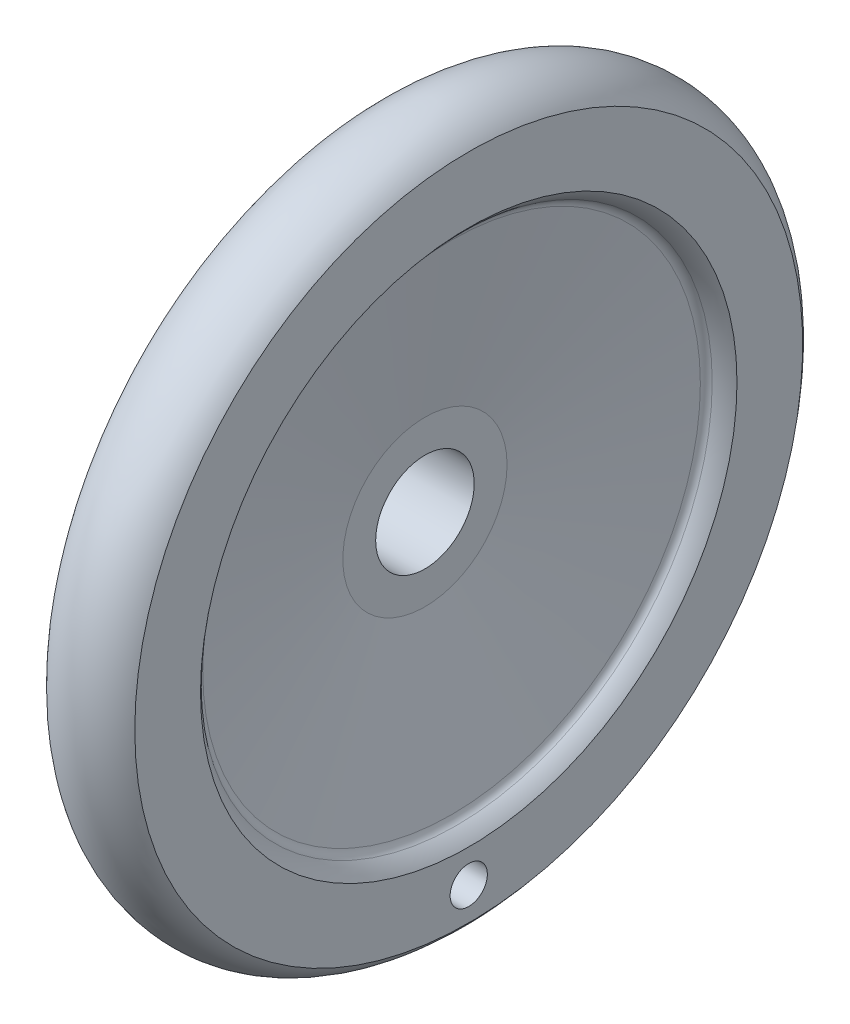
from build123d import *

# Parameters (mm, degrees)
CUT_EXTRUDE_1_DEPTH      = 99.361577997
CUT_EXTRUDE_1_DEPTH_BACK = 99.361577997
SKETCH_2_R               = 4
CHAMFER_1_SIZE           = 1
FILLET_1_R               = 2
HOLE_WIZARD_M8_1_D       = 6.8


with BuildPart() as part:
    # 草图1 → 旋转1 (revolve)
    with BuildSketch(Plane.XY, mode=Mode.PRIVATE) as revolve_1_sk:
        with BuildLine():
            Line((0, 49), (0, 61))
            ThreePointArc((0, 61), (-15.841903734, 61.205203126), (-12, 45.83484861))
            Line((-12, 45.83484861), (-16.087875382, 20.21225341))
            ThreePointArc((-16.087875382, 20.21225341), (-17.780337221, 17.196137953), (-21.025430983, 16))
            Line((-21.025430983, 16), (-35, 16))
            Line((-35, 16), (-35, 9))
            Line((-35, 9), (-8, 9))
            Line((-8, 9), (-8, 15))
            Line((-8, 15), (-3, 46.339745962))
            ThreePointArc((-3, 46.339745962), (-1.365300468, 47.517970722), (0, 49))
        make_face()
    revolve(revolve_1_sk.sketch.rotate(Axis((0, 0, 0), (1, 0, 0)), 90), axis=Axis((0, 0, 0), (1, 0, 0)))

    # 草图2 → 切除-拉伸1 (cut, two sides: drawn at the far end of the back side and taken through both)
    with BuildSketch(Plane(origin=(0, 0, 0), x_dir=(1, 0, 0), z_dir=(0, 1, 0)).offset(-CUT_EXTRUDE_1_DEPTH_BACK)):
        with Locations(Location((-26, 0, 0), (0, 0, 270))):
            Circle(SKETCH_2_R)
    extrude(amount=CUT_EXTRUDE_1_DEPTH + CUT_EXTRUDE_1_DEPTH_BACK, mode=Mode.SUBTRACT)

    # 倒角1
    chamfer_1_edges = [part.edges().sort_by_distance(p)[0] for p in [
        (-35, 0, -9),
    ]]
    chamfer(chamfer_1_edges, length=CHAMFER_1_SIZE)

    # 圆角1
    fillet_1_edges = [part.edges().sort_by_distance(p)[0] for p in [
        (-12, 0, -45.83484861),
        (-3, 0, -46.339745962),
    ]]
    fillet(fillet_1_edges, radius=FILLET_1_R)

    # M8 螺纹孔的螺纹孔钻头1 (through all)
    with Locations(Plane(origin=(0, 0, 0), x_dir=(0, 0, -1), z_dir=(1, 0, 0))):
        with Locations((0, -55)):
            Hole(HOLE_WIZARD_M8_1_D / 2)


solid = part.part
